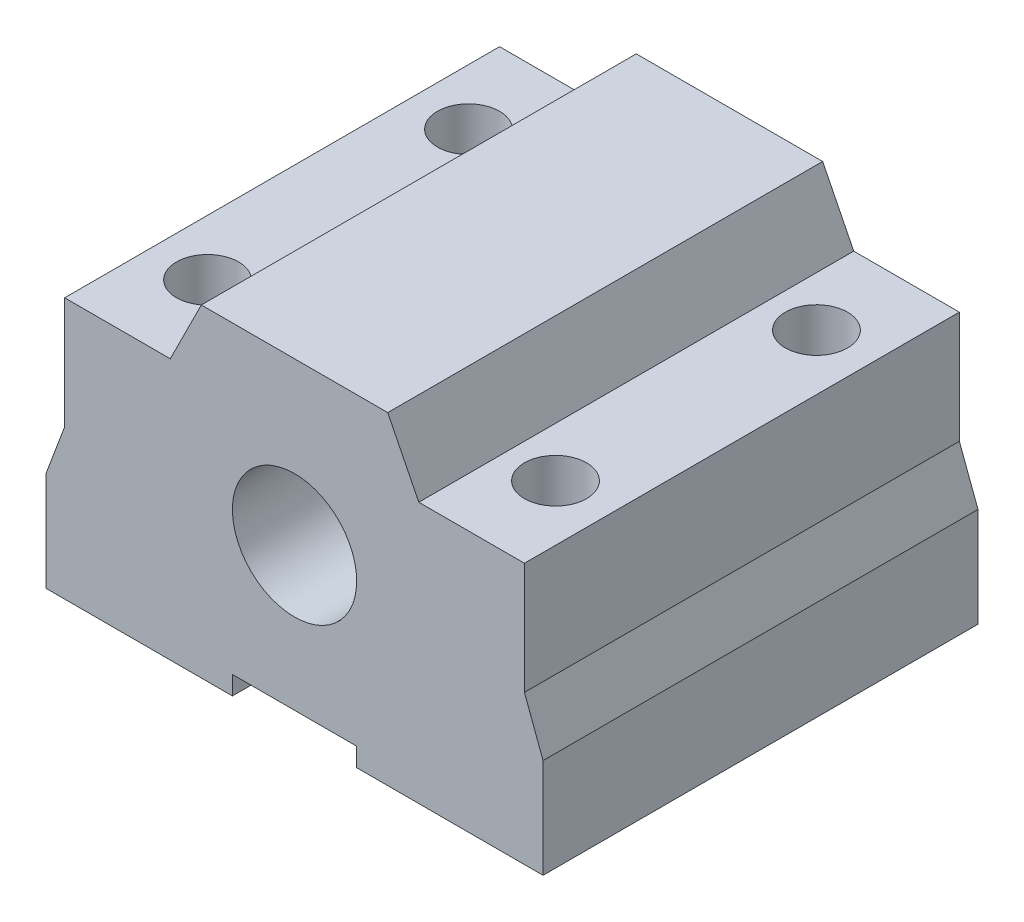
from build123d import *

# Parameters (mm, degrees)
SKETCH_1_R          = 5
EXTRUDE_1_DEPTH     = 35
SKETCH_2_R          = 2.5
CUT_EXTRUDE_1_DEPTH = 48.968739821


with BuildPart() as part:
    # Эскиз1 → Бобышка-Вытянуть1 (new body)
    with BuildSketch(Plane.XY):
        Polygon((-18.5, 21), (-10, 21), (-7.5, 26), (7.5, 26), (10, 21), (18.5, 21), (18.5, 12), (20, 8), (20, 0), (5, 0), (5, 1.5), (-5, 1.5), (-5, 0), (-20, 0), (-20, 8), (-18.5, 12), align=None)
        with Locations((0, 13)):
            Circle(SKETCH_1_R, mode=Mode.SUBTRACT)
    extrude(amount=EXTRUDE_1_DEPTH)

    # Эскиз2 → Вырез-Вытянуть1 (cut, through all)
    with BuildSketch(Plane.XZ):
        with Locations(Location((-14, 28, 0), (0, 0, 270))):
            Circle(SKETCH_2_R)
        with Locations(Location((14, 28, 0), (0, 0, 270))):
            Circle(SKETCH_2_R)
        with Locations(Location((14, 7, 0), (0, 0, 270))):
            Circle(SKETCH_2_R)
        with Locations(Location((-14, 7, 0), (0, 0, 270))):
            Circle(SKETCH_2_R)
    extrude(amount=-CUT_EXTRUDE_1_DEPTH, mode=Mode.SUBTRACT)


solid = part.part
